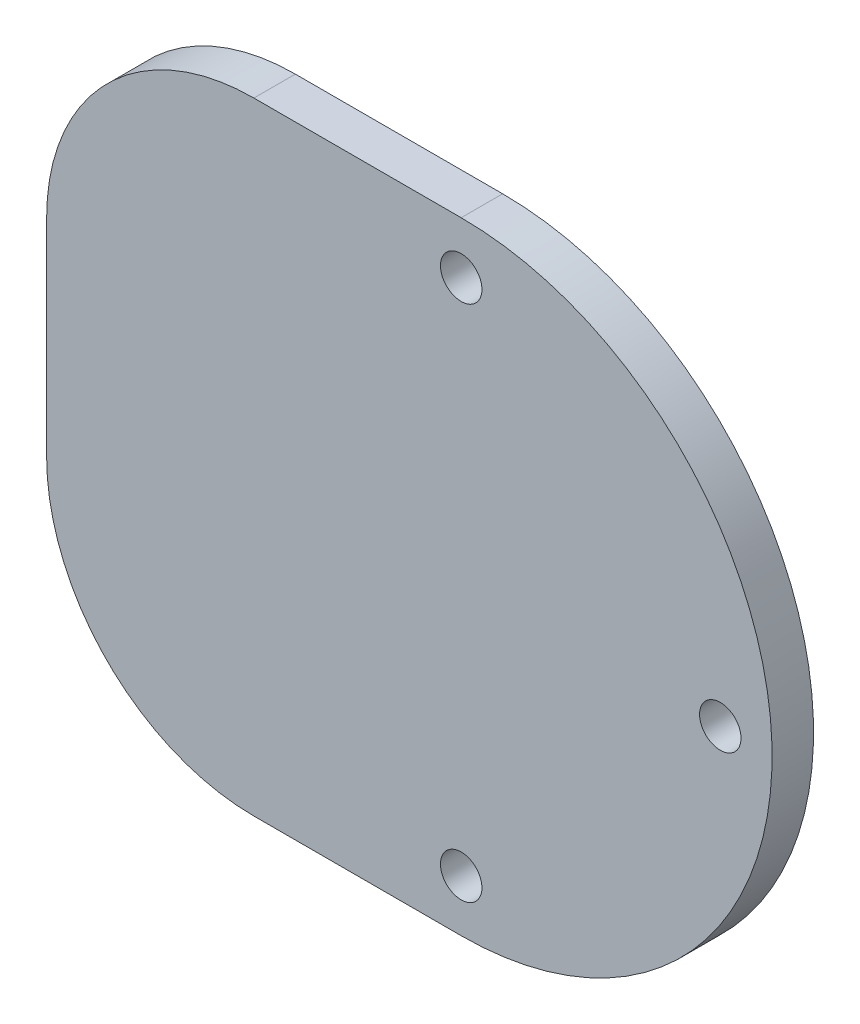
from build123d import *

# Parameters (mm, degrees)
BOSS_EXTRUDE1_DEPTH = 10
SKETCH2_R           = 5
CUT_EXTRUDE1_DEPTH  = 10
FILLET1_R           = 50


with BuildPart() as part:
    # Sketch1 → Boss-Extrude1 (new body)
    with BuildSketch(Plane.XY):
        with BuildLine():
            Line((0, 75), (-100, 75))
            Line((-100, 75), (-100, -75))
            Line((-100, -75), (0, -75))
            ThreePointArc((0, -75), (75, 0), (0, 75))
        make_face()
    extrude(amount=BOSS_EXTRUDE1_DEPTH)

    # Sketch2 → Cut-Extrude1 (cut)
    with BuildSketch(Plane.XY.offset(10)):
        with Locations((0, 62.5)):
            Circle(SKETCH2_R)
        with Locations((62.5, 0)):
            Circle(SKETCH2_R)
        with Locations((0, -62.5)):
            Circle(SKETCH2_R)
    extrude(amount=-CUT_EXTRUDE1_DEPTH, mode=Mode.SUBTRACT)

    # Fillet1
    fillet1_edges = [part.edges().sort_by_distance(p)[0] for p in [
        (-100, -75, 5),
        (-100, 75, 5),
    ]]
    fillet(fillet1_edges, radius=FILLET1_R)


solid = part.part
